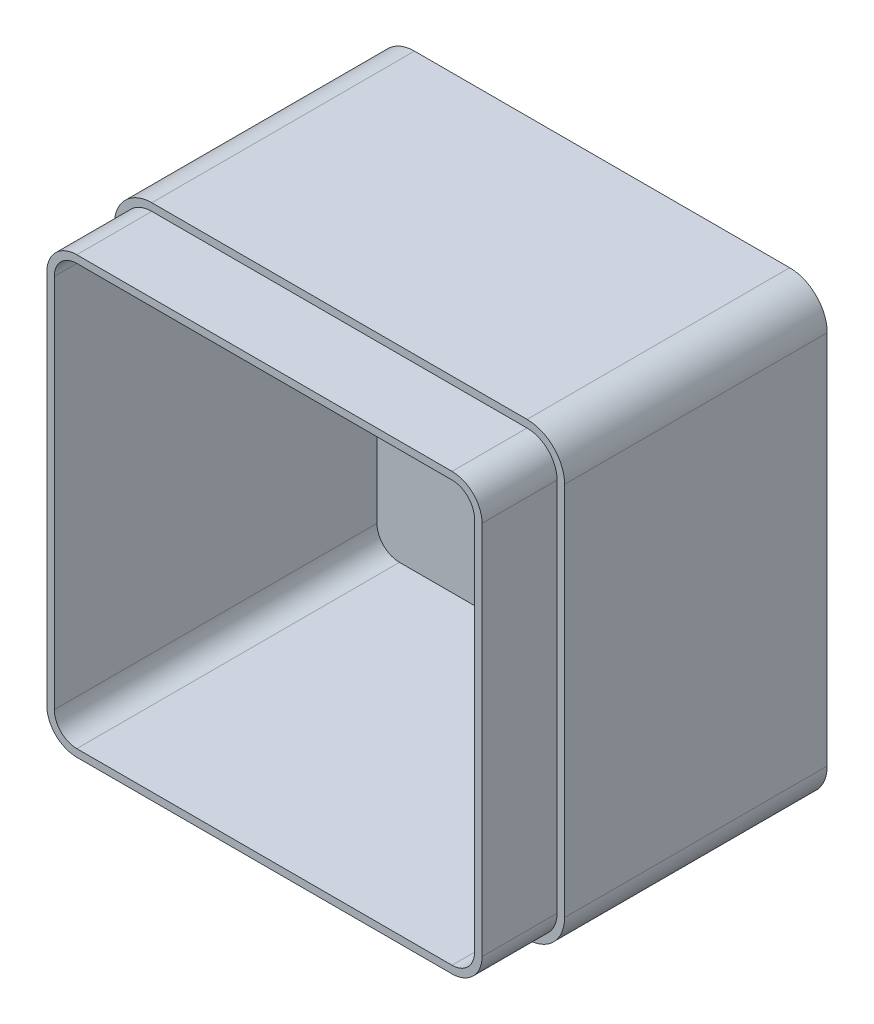
from build123d import *

# Parameters (mm, degrees)
SKETCH1_W           = 120
SKETCH1_H           = 120
BOSS_EXTRUDE1_DEPTH = 90
FILLET1_R           = 10
SHELL1_T            = -4
CUT_EXTRUDE3_DEPTH  = 20


with BuildPart() as part:
    # Sketch1 → Boss-Extrude1 (new body)
    with BuildSketch(Plane.XY):
        with Locations((-60, 60)):
            Rectangle(SKETCH1_W, SKETCH1_H)
    extrude(amount=BOSS_EXTRUDE1_DEPTH)

    # Fillet1
    fillet1_edges = [part.edges().sort_by_distance(p)[0] for p in [
        (-120, 120, 45),
        (0, 120, 45),
        (0, 0, 45),
        (-120, 0, 45),
    ]]
    fillet(fillet1_edges, radius=FILLET1_R)

    # Shell1
    shell1_openings = [part.faces().sort_by_distance(p)[0] for p in [
        (-60, 60, 90),
    ]]
    offset(amount=SHELL1_T, openings=shell1_openings, kind=Kind.INTERSECTION)

    # Sketch9 → Cut-Extrude3 (cut)
    with BuildSketch(Plane.XY.offset(90)):
        with BuildLine():
            Line((-120, 110), (-120, 10))
            ThreePointArc((-120, 10), (-117.071067812, 2.928932188), (-110, 0))
            Line((-110, 0), (-10, 0))
            ThreePointArc((-10, 0), (-2.928932188, 2.928932188), (0, 10))
            Line((0, 10), (0, 110))
            ThreePointArc((0, 110), (-2.928932188, 117.071067812), (-10, 120))
            Line((-10, 120), (-110, 120))
            ThreePointArc((-110, 120), (-117.071067812, 117.071067812), (-120, 110))
        make_face()
        with BuildLine():
            Line((-118, 110), (-118, 10))
            ThreePointArc((-118, 10), (-115.656854249, 4.343145751), (-110, 2))
            Line((-110, 2), (-10, 2))
            ThreePointArc((-10, 2), (-4.343145751, 4.343145751), (-2, 10))
            Line((-2, 10), (-2, 110))
            ThreePointArc((-2, 110), (-4.343145751, 115.656854249), (-10, 118))
            Line((-10, 118), (-110, 118))
            ThreePointArc((-110, 118), (-115.656854249, 115.656854249), (-118, 110))
        make_face(mode=Mode.SUBTRACT)
    extrude(amount=-CUT_EXTRUDE3_DEPTH, mode=Mode.SUBTRACT)


solid = part.part
